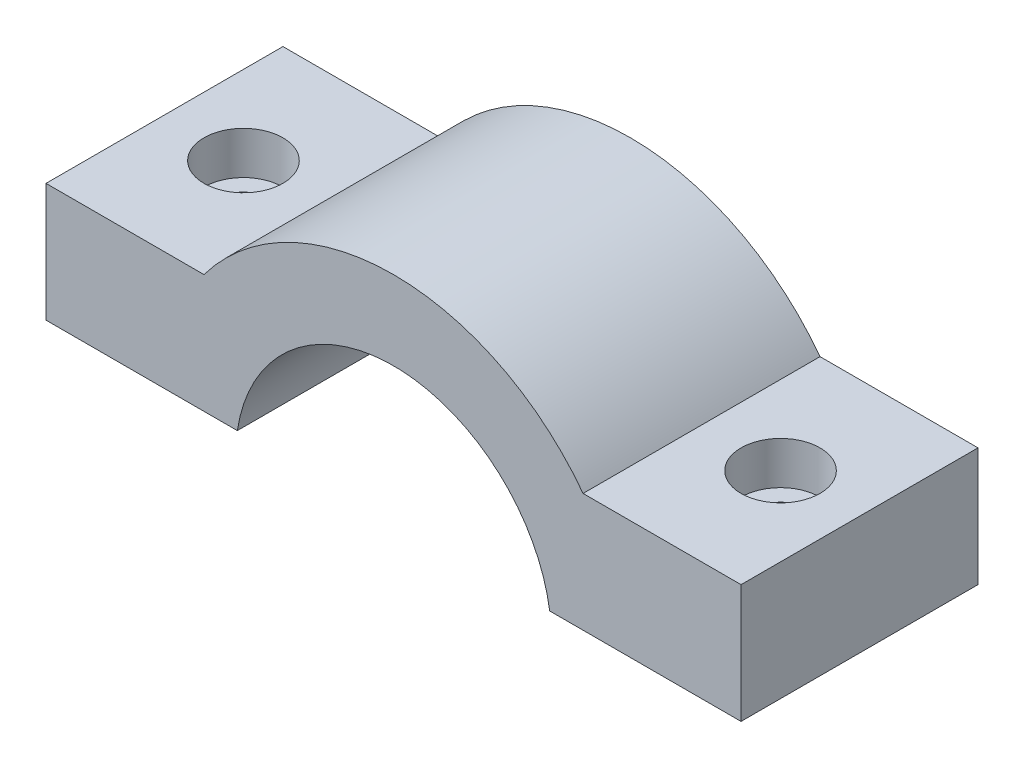
from build123d import *

# Parameters (mm, degrees)
BOSS_EXTRU_1_DEPTH                                 = 15
CHAMBRAGE_POUR_VIS_T_TE_HEXAGONALE_M51_D           = 5.5
CHAMBRAGE_POUR_VIS_T_TE_HEXAGONALE_M51_CBORE_D     = 10
CHAMBRAGE_POUR_VIS_T_TE_HEXAGONALE_M51_CBORE_DEPTH = 5.4


with BuildPart() as part:
    # Esquisse1 → Boss.-Extru.1 (new, symmetric)
    with BuildSketch(Plane.XY):
        with BuildLine():
            Line((43.383109312, -1.070799618), (67.609389379, -1.070799618))
            ThreePointArc((67.609389379, -1.070799618), (87.383109312, 15.929200382), (107.156829246, -1.070799618))
            Line((107.156829246, -1.070799618), (131.383109312, -1.070799618))
            Line((131.383109312, -1.070799618), (131.383109312, 13.929200382))
            Line((131.383109312, 13.929200382), (111.383109312, 13.929200382))
            ThreePointArc((111.383109312, 13.929200382), (87.383109312, 25.929200382), (63.383109312, 13.929200382))
            Line((63.383109312, 13.929200382), (43.383109312, 13.929200382))
            Line((43.383109312, 13.929200382), (43.383109312, -1.070799618))
        make_face()
    extrude(amount=BOSS_EXTRU_1_DEPTH, both=True)

    # Chambrage pour vis à tête hexagonale M51 (through all)
    with Locations(Plane(origin=(53.383109312, 13.929200382, 0), x_dir=(0, 0, 1), z_dir=(0, 1, 0))):
        with Locations((0, 0), (0, 68)):
            CounterBoreHole(CHAMBRAGE_POUR_VIS_T_TE_HEXAGONALE_M51_D / 2, CHAMBRAGE_POUR_VIS_T_TE_HEXAGONALE_M51_CBORE_D / 2, CHAMBRAGE_POUR_VIS_T_TE_HEXAGONALE_M51_CBORE_DEPTH)


solid = part.part
